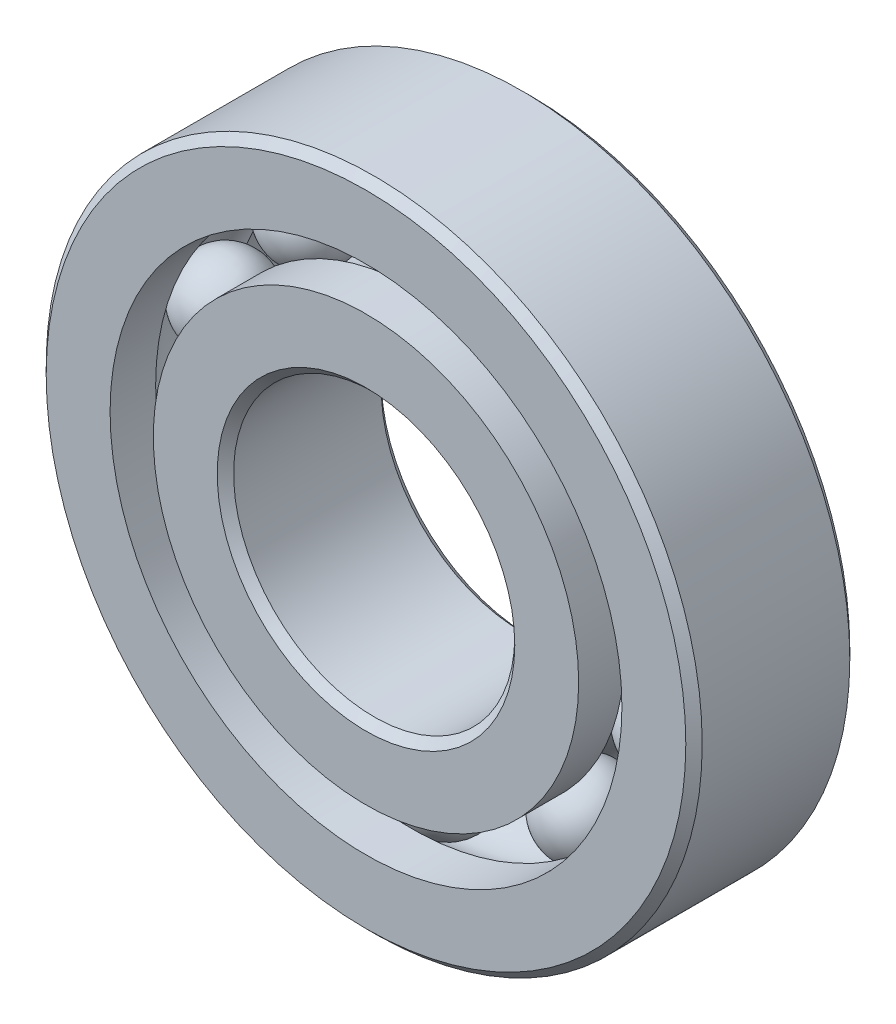
from build123d import *

# Parameters (mm, degrees)
CIRPATTERN1_COUNT = 10


with BuildPart() as part:
    # Sketch1 → Revolve1 (revolve)
    with BuildSketch(Plane(origin=(0, 0, 0), x_dir=(0, 0, -1), z_dir=(1, 0, 0))):
        with BuildLine():
            Line((2.5003125, 11.1125), (-2.5003125, 11.1125))
            Line((-2.5003125, 11.1125), (-2.778125, 10.8346875))
            Line((-2.778125, 10.8346875), (-2.778125, 8.670192308))
            Line((-2.778125, 8.670192308), (-1.234722222, 8.670192308))
            ThreePointArc((-1.234722222, 8.670192308), (0, 9.373249624), (1.234722222, 8.670192308))
            Line((1.234722222, 8.670192308), (2.778125, 8.670192308))
            Line((2.778125, 8.670192308), (2.778125, 10.8346875))
            Line((2.778125, 10.8346875), (2.5003125, 11.1125))
        make_face()
    revolve(axis=Axis((0, 0, 2.778125), (0, 0, -1)))


with BuildPart() as body_2:
    # Sketch3 → Revolve3 (revolve)
    with BuildSketch(Plane(origin=(0, 0, 0), x_dir=(0, 0, -1), z_dir=(1, 0, 0))):
        with BuildLine():
            Line((-2.778125, 7.204807692), (-1.234722222, 7.204807692))
            ThreePointArc((-1.234722222, 7.204807692), (0, 6.501750376), (1.234722222, 7.204807692))
            Line((1.234722222, 7.204807692), (2.778125, 7.204807692))
            Line((2.778125, 7.204807692), (2.778125, 5.0403125))
            Line((2.778125, 5.0403125), (2.5003125, 4.7625))
            Line((2.5003125, 4.7625), (-2.5003125, 4.7625))
            Line((-2.5003125, 4.7625), (-2.778125, 5.0403125))
            Line((-2.778125, 5.0403125), (-2.778125, 7.204807692))
        make_face()
    revolve(axis=Axis((0, 0, 2.778125), (0, 0, -1)))


with BuildPart() as body_3:
    # Sketch4 → Revolve4 (revolve)
    with BuildSketch(Plane(origin=(0, 0, 0), x_dir=(0, 0, -1), z_dir=(1, 0, 0))):
        with BuildLine():
            Line((-1.435749624, 7.9375), (1.435749624, 7.9375))
            ThreePointArc((1.435749624, 7.9375), (0, 9.373249624), (-1.435749624, 7.9375))
        make_face()
    revolve(axis=Axis((0, 7.9375, 1.435749624), (0, 0, -1)))


with BuildPart() as cirpattern1_1:
    # CirPattern1: pattern copy
    add(body_3.part.rotate(Axis((0, 0, -2.778125), (0, 0, 1)), 1 * 360 / CIRPATTERN1_COUNT))


with BuildPart() as cirpattern1_2:
    # CirPattern1: pattern copy
    add(body_3.part.rotate(Axis((0, 0, -2.778125), (0, 0, 1)), 2 * 360 / CIRPATTERN1_COUNT))


with BuildPart() as cirpattern1_3:
    # CirPattern1: pattern copy
    add(body_3.part.rotate(Axis((0, 0, -2.778125), (0, 0, 1)), 3 * 360 / CIRPATTERN1_COUNT))


with BuildPart() as cirpattern1_4:
    # CirPattern1: pattern copy
    add(body_3.part.rotate(Axis((0, 0, -2.778125), (0, 0, 1)), 4 * 360 / CIRPATTERN1_COUNT))


with BuildPart() as cirpattern1_5:
    # CirPattern1: pattern copy
    add(body_3.part.rotate(Axis((0, 0, -2.778125), (0, 0, 1)), 5 * 360 / CIRPATTERN1_COUNT))


with BuildPart() as cirpattern1_6:
    # CirPattern1: pattern copy
    add(body_3.part.rotate(Axis((0, 0, -2.778125), (0, 0, 1)), 6 * 360 / CIRPATTERN1_COUNT))


with BuildPart() as cirpattern1_7:
    # CirPattern1: pattern copy
    add(body_3.part.rotate(Axis((0, 0, -2.778125), (0, 0, 1)), 7 * 360 / CIRPATTERN1_COUNT))


with BuildPart() as cirpattern1_8:
    # CirPattern1: pattern copy
    add(body_3.part.rotate(Axis((0, 0, -2.778125), (0, 0, 1)), 8 * 360 / CIRPATTERN1_COUNT))


with BuildPart() as cirpattern1_9:
    # CirPattern1: pattern copy
    add(body_3.part.rotate(Axis((0, 0, -2.778125), (0, 0, 1)), 9 * 360 / CIRPATTERN1_COUNT))


solid = Compound([part.part, body_2.part, body_3.part, cirpattern1_1.part, cirpattern1_2.part, cirpattern1_3.part, cirpattern1_4.part, cirpattern1_5.part, cirpattern1_6.part, cirpattern1_7.part, cirpattern1_8.part, cirpattern1_9.part])
